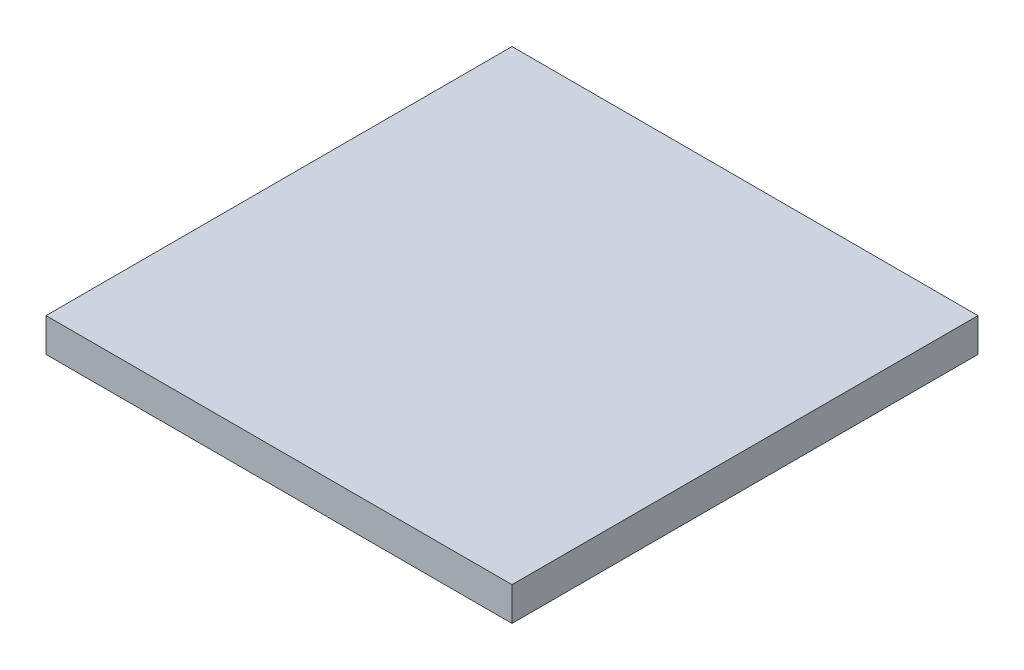
from build123d import *

# Parameters (mm, degrees)
SKETCH1_W           = 192
SKETCH1_H           = 192
SKETCH1_R           = 1.5
BOSS_EXTRUDE1_DEPTH = 13.85
SKETCH1_3_R         = 1.5
CUT_EXTRUDE1_DEPTH  = 11.85
SKETCH1_4_R         = 1.5
BOSS_EXTRUDE2_DEPTH = 3.5
CIRPATTERN1_COUNT   = 2
BOSS_EXTRUDE4_START = -2
SKETCH2_W           = 8.75
SKETCH2_H           = 27.8
SKETCH2_H_2         = 16
BOSS_EXTRUDE4_DEPTH = 9.5
BOSS_EXTRUDE5_START = -2
SKETCH2_3_R         = 3.5
BOSS_EXTRUDE5_DEPTH = 5.5


with BuildPart() as part:
    # Sketch1 → Boss-Extrude1 (new body)
    # profile 1 of 7: a face of its own
    with BuildSketch(Plane(origin=(0, 0, 0), x_dir=(1, 0, 0), z_dir=(0, 1, 0))):
        Rectangle(SKETCH1_W, SKETCH1_H)
        with Locations((62.5, -87.5)):
            Circle(SKETCH1_R, mode=Mode.SUBTRACT)
        with Locations((12, 85)):
            Circle(SKETCH1_R, mode=Mode.SUBTRACT)
        with Locations((85, 73)):
            Circle(SKETCH1_R, mode=Mode.SUBTRACT)
        with Locations((85, 0)):
            Circle(SKETCH1_R, mode=Mode.SUBTRACT)
        with Locations((85, -73)):
            Circle(SKETCH1_R, mode=Mode.SUBTRACT)
        with BuildLine():
            Line((5, 11.25), (65, 11.25))
            ThreePointArc((65, 11.25), (75.606601718, 15.643398282), (80, 26.25))
            Line((80, 26.25), (80, 65))
            ThreePointArc((80, 65), (75.606601718, 75.606601718), (65, 80))
            Line((65, 80), (-65, 80))
            ThreePointArc((-65, 80), (-75.606601718, 75.606601718), (-80, 65))
            Line((-80, 65), (-80, 26.25))
            ThreePointArc((-80, 26.25), (-75.606601718, 15.643398282), (-65, 11.25))
            Line((-65, 11.25), (-5, 11.25))
            ThreePointArc((-5, 11.25), (0, 16.25), (5, 11.25))
        make_face(mode=Mode.SUBTRACT)
    # profile 2 of 7: a face of its own
    with BuildSketch(Plane(origin=(0, 0, 0), x_dir=(1, 0, 0), z_dir=(0, 1, 0))):
        with BuildLine():
            ThreePointArc((5, 11.25), (0, 16.25), (-5, 11.25))
            Line((-5, 11.25), (-65, 11.25))
            ThreePointArc((-65, 11.25), (-75.606601718, 15.643398282), (-80, 26.25))
            Line((-80, 26.25), (-80, 65))
            ThreePointArc((-80, 65), (-75.606601718, 75.606601718), (-65, 80))
            Line((-65, 80), (65, 80))
            ThreePointArc((65, 80), (75.606601718, 75.606601718), (80, 65))
            Line((80, 65), (80, 26.25))
            ThreePointArc((80, 26.25), (75.606601718, 15.643398282), (65, 11.25))
            Line((65, 11.25), (5, 11.25))
        make_face()
    # profile 3 of 7: a face of its own
    with BuildSketch(Plane(origin=(0, 0, 0), x_dir=(1, 0, 0), z_dir=(0, 1, 0))):
        with Locations((62.5, -87.5)):
            Circle(SKETCH1_R)
    # profile 4 of 7: a face of its own
    with BuildSketch(Plane(origin=(0, 0, 0), x_dir=(1, 0, 0), z_dir=(0, 1, 0))):
        with Locations((85, -73)):
            Circle(SKETCH1_R)
    # profile 5 of 7: a face of its own
    with BuildSketch(Plane(origin=(0, 0, 0), x_dir=(1, 0, 0), z_dir=(0, 1, 0))):
        with Locations((85, 0)):
            Circle(SKETCH1_R)
    # profile 6 of 7: a face of its own
    with BuildSketch(Plane(origin=(0, 0, 0), x_dir=(1, 0, 0), z_dir=(0, 1, 0))):
        with Locations((85, 73)):
            Circle(SKETCH1_R)
    # profile 7 of 7: a face of its own
    with BuildSketch(Plane(origin=(0, 0, 0), x_dir=(1, 0, 0), z_dir=(0, 1, 0))):
        with Locations((12, 85)):
            Circle(SKETCH1_R)
    extrude(amount=BOSS_EXTRUDE1_DEPTH)

    # Sketch1<3> → Cut-Extrude1 (cut)
    with BuildSketch(Plane(origin=(0, 0, 0), x_dir=(1, 0, 0), z_dir=(0, 1, 0))):
        with BuildLine():
            ThreePointArc((5, 11.25), (0, 16.25), (-5, 11.25))
            Line((-5, 11.25), (-65, 11.25))
            ThreePointArc((-65, 11.25), (-75.606601718, 15.643398282), (-80, 26.25))
            Line((-80, 26.25), (-80, 65))
            ThreePointArc((-80, 65), (-75.606601718, 75.606601718), (-65, 80))
            Line((-65, 80), (65, 80))
            ThreePointArc((65, 80), (75.606601718, 75.606601718), (80, 65))
            Line((80, 65), (80, 26.25))
            ThreePointArc((80, 26.25), (75.606601718, 15.643398282), (65, 11.25))
            Line((65, 11.25), (5, 11.25))
        make_face()
        with Locations(Location((85, -73, 0), (0, 0, 270))):
            Circle(SKETCH1_3_R)
        with Locations(Location((85, 73, 0), (0, 0, 270))):
            Circle(SKETCH1_3_R)
        with Locations(Location((12, 85, 0), (0, 0, 270))):
            Circle(SKETCH1_3_R)
        with Locations(Location((85, 0, 0), (0, 0, 270))):
            Circle(SKETCH1_3_R)
    cut_extrude1 = extrude(amount=CUT_EXTRUDE1_DEPTH, mode=Mode.SUBTRACT)

    # Sketch1<4> → Boss-Extrude2 (add)
    with BuildSketch(Plane(origin=(0, 0, 0), x_dir=(1, 0, 0), z_dir=(0, 1, 0))):
        with Locations(Location((62.5, -87.5, 0), (0, 0, 270))):
            Circle(SKETCH1_4_R)
    boss_extrude2 = extrude(amount=-BOSS_EXTRUDE2_DEPTH)

    # CirPattern1: Cut-Extrude1, Boss-Extrude2 ×2 about axis
    cirpattern1_axis = Axis((0, 0, 0), (0, 1, 0))
    add([cut_extrude1.rotate(cirpattern1_axis, i * 360 / CIRPATTERN1_COUNT) for i in range(1, CIRPATTERN1_COUNT)], mode=Mode.SUBTRACT)
    add([boss_extrude2.rotate(cirpattern1_axis, i * 360 / CIRPATTERN1_COUNT) for i in range(1, CIRPATTERN1_COUNT)])

    # Sketch2 → Boss-Extrude4 (add)
    with BuildSketch(Plane(origin=(0, 13.85, 0), x_dir=(1, 0, 0), z_dir=(0, 1, 0)).offset(BOSS_EXTRUDE4_START)):
        with Locations((57.125, 52.1)):
            Rectangle(SKETCH2_W, SKETCH2_H)
        with Locations((-15.375, 48)):
            Rectangle(SKETCH2_W, SKETCH2_H_2)
        with Locations((-55.875, 52.1)):
            Rectangle(SKETCH2_W, SKETCH2_H)
    extrude(amount=-BOSS_EXTRUDE4_DEPTH)

    # Sketch2<3> → Boss-Extrude5 (add)
    with BuildSketch(Plane(origin=(0, 13.85, 0), x_dir=(1, 0, 0), z_dir=(0, 1, 0)).offset(BOSS_EXTRUDE5_START)):
        with Locations(Location((29, 49, 0), (0, 0, 270))):
            Circle(SKETCH2_3_R)
        with Locations(Location((-31, 49, 0), (0, 0, 270))):
            Circle(SKETCH2_3_R)
        with Locations(Location((29, -47, 0), (0, 0, 270))):
            Circle(SKETCH2_3_R)
        with Locations(Location((-31, -47, 0), (0, 0, 270))):
            Circle(SKETCH2_3_R)
    extrude(amount=-BOSS_EXTRUDE5_DEPTH)


solid = part.part
